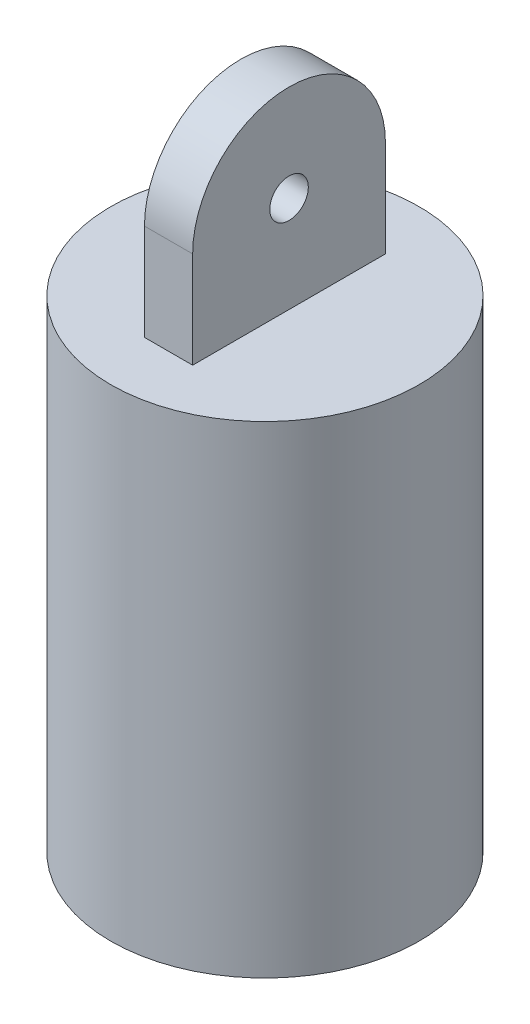
from build123d import *

# Parameters (mm, degrees)
SKETCH1_R           = 16
SKETCH1_R_2         = 12.7
BOSS_EXTRUDE1_DEPTH = 40
SKETCH2_R           = 16
BOSS_EXTRUDE2_DEPTH = 10
BOSS_EXTRUDE3_DEPTH = 20
CUT_EXTRUDE1_DEPTH  = 5


with BuildPart() as part:
    # Sketch1 → Boss-Extrude1 (new body)
    with BuildSketch(Plane(origin=(0, 0, 0), x_dir=(1, 0, 0), z_dir=(0, 1, 0))):
        with Locations(Location((0, 0, 0), (0, 0, 270))):
            Circle(SKETCH1_R)
        with Locations(Location((0, 0, 0), (0, 0, 270))):
            Circle(SKETCH1_R_2, mode=Mode.SUBTRACT)
    extrude(amount=BOSS_EXTRUDE1_DEPTH)

    # Sketch2 → Boss-Extrude2 (add)
    with BuildSketch(Plane(origin=(0, 40, 0), x_dir=(1, 0, 0), z_dir=(0, 1, 0))):
        with Locations(Location((0, 0, 0), (0, 0, 270))):
            Circle(SKETCH2_R)
    extrude(amount=BOSS_EXTRUDE2_DEPTH)

    # Sketch3 → Boss-Extrude3 (add)
    with BuildSketch(Plane(origin=(0, 50, 0), x_dir=(1, 0, 0), z_dir=(0, 1, 0))):
        Polygon((0, -10), (0, 0), (0, 10), (-2.5, 10), (-2.5, -10), align=None)
        Polygon((0, 10), (0, 0), (0, -10), (2.5, -10), (2.5, 10), align=None)
    extrude(amount=BOSS_EXTRUDE3_DEPTH)

    # Sketch4 → Cut-Extrude1 (cut)
    with BuildSketch(Plane(origin=(2.5, 0, 0), x_dir=(0, 0, -1), z_dir=(1, 0, 0))):
        with BuildLine():
            Line((0, 70), (-10, 70))
            Line((-10, 70), (-10, 60))
            ThreePointArc((-10, 60), (-7.071067812, 67.071067812), (0, 70))
        make_face()
        with BuildLine():
            Line((10, 70), (0, 70))
            ThreePointArc((0, 70), (7.071067812, 67.071067812), (10, 60))
            Line((10, 60), (10, 70))
        make_face()
        with BuildLine():
            ThreePointArc((2, 60), (1.414213562, 61.414213562), (0, 62))
            Line((0, 62), (0, 58))
            ThreePointArc((0, 58), (1.414213562, 58.585786438), (2, 60))
        make_face()
        with BuildLine():
            Line((0, 58), (0, 62))
            ThreePointArc((0, 62), (-2, 60), (0, 58))
        make_face()
    extrude(amount=-CUT_EXTRUDE1_DEPTH, mode=Mode.SUBTRACT)


solid = part.part
